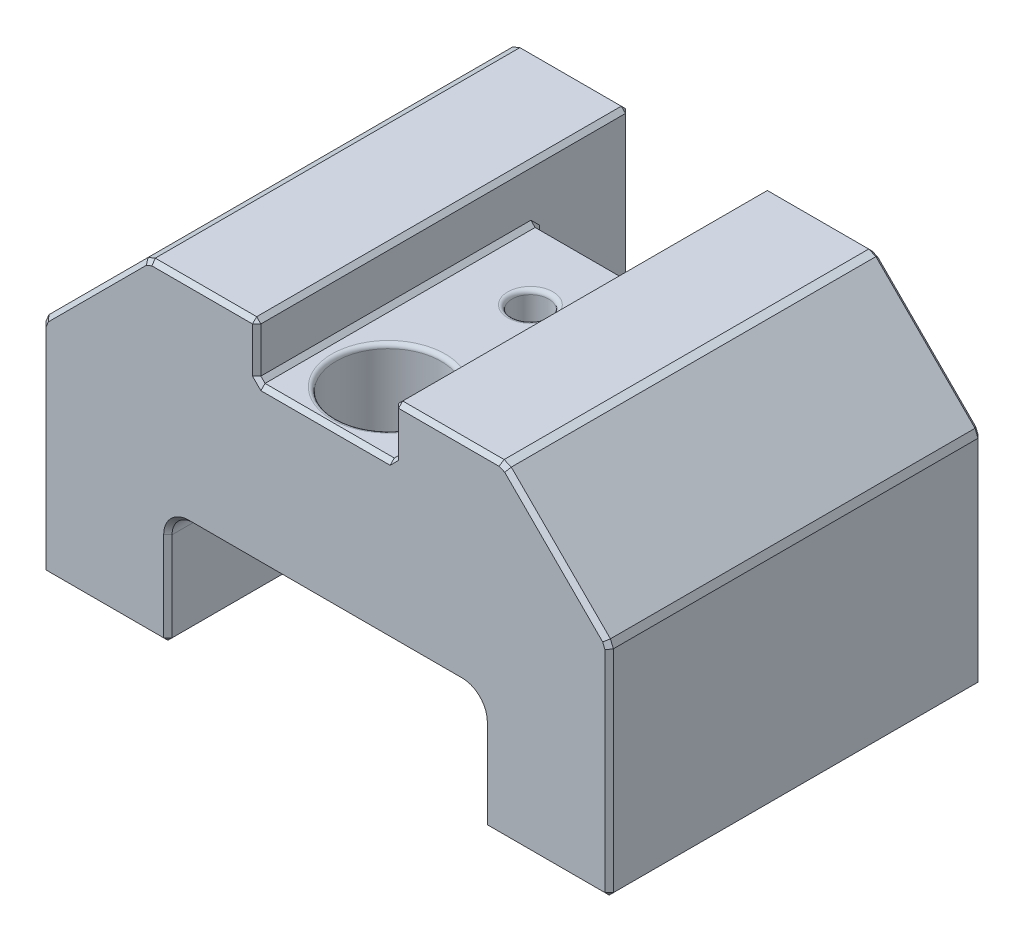
from build123d import *

# Parameters (mm, degrees)
BOSS_EXTRUDE1_DEPTH = 23
BOSS_EXTRUDE5_START = 23
SKETCH1_9_W         = 13.1
SKETCH1_9_H         = 9.8
SKETCH1_9_H_2       = 5.1
BOSS_EXTRUDE5_DEPTH = 12.5
SKETCH1_4_W         = 13.1
SKETCH1_4_H         = 9.8
CUT_EXTRUDE1_DEPTH  = 9
CHAMFER4_SIZE       = 10
CHAMFER6_SIZE       = 0.4
CUT_EXTRUDE5_DEPTH  = 52.525624693
SKETCH6_4_R         = 1.75
SKETCH6_4_R_2       = 5
SKETCH6_4_R_3       = 2.55
CUT_EXTRUDE6_DEPTH  = 12
CHAMFER7_SIZE       = 0.4
FILLET1_R           = 0.4


with BuildPart() as part:
    # Sketch1 → Boss-Extrude1 (new body)
    with BuildSketch(Plane.XY):
        with BuildLine():
            Line((-27, 4.1), (-15, 4.1))
            Line((-15, 4.1), (-15, 13))
            ThreePointArc((-15, 13), (-14.414213562, 14.414213562), (-13, 15))
            Line((-13, 15), (-6.55, 15))
            Line((-6.55, 15), (-6.55, 20.1))
            Line((-6.55, 20.1), (6.55, 20.1))
            Line((6.55, 20.1), (6.55, 15))
            Line((6.55, 15), (13, 15))
            ThreePointArc((13, 15), (14.414213562, 14.414213562), (15, 13))
            Line((15, 13), (15, 4.1))
            Line((15, 4.1), (27, 4.1))
            Line((27, 4.1), (27, 35))
            Line((27, 35), (6.55, 35))
            Line((6.55, 35), (6.55, 29.9))
            Line((6.55, 29.9), (-6.55, 29.9))
            Line((-6.55, 29.9), (-6.55, 35))
            Line((-6.55, 35), (-27, 35))
            Line((-27, 35), (-27, 4.1))
        make_face()
    extrude(amount=BOSS_EXTRUDE1_DEPTH)

    # Sketch1<9> → Boss-Extrude5 (add)
    with BuildSketch(Plane.XY.offset(BOSS_EXTRUDE5_START)):
        with BuildLine():
            Line((-27, 4.1), (-15, 4.1))
            Line((-15, 4.1), (-15, 13))
            ThreePointArc((-15, 13), (-14.414213562, 14.414213562), (-13, 15))
            Line((-13, 15), (-6.55, 15))
            Line((-6.55, 15), (-6.55, 20.1))
            Line((-6.55, 20.1), (-6.55, 29.9))
            Line((-6.55, 29.9), (-6.55, 35))
            Line((-6.55, 35), (-27, 35))
            Line((-27, 35), (-27, 4.1))
        make_face()
        with Locations((0, 25)):
            Rectangle(SKETCH1_9_W, SKETCH1_9_H)
        with BuildLine():
            Line((6.55, 20.1), (6.55, 15))
            Line((6.55, 15), (13, 15))
            ThreePointArc((13, 15), (14.414213562, 14.414213562), (15, 13))
            Line((15, 13), (15, 4.1))
            Line((15, 4.1), (27, 4.1))
            Line((27, 4.1), (27, 35))
            Line((27, 35), (6.55, 35))
            Line((6.55, 35), (6.55, 29.9))
            Line((6.55, 29.9), (6.55, 20.1))
        make_face()
        with Locations((0, 17.55)):
            Rectangle(SKETCH1_9_W, SKETCH1_9_H_2)
    extrude(amount=BOSS_EXTRUDE5_DEPTH)

    # Sketch1<4> → Cut-Extrude1 (cut)
    with BuildSketch(Plane.XY):
        with Locations((0, 25)):
            Rectangle(SKETCH1_4_W, SKETCH1_4_H)
    extrude(amount=CUT_EXTRUDE1_DEPTH, mode=Mode.SUBTRACT)

    # Chamfer4
    chamfer4_edges = [part.edges().sort_by_distance(p)[0] for p in [
        (-27, 35, 17.75),
        (27, 35, 17.75),
    ]]
    chamfer(chamfer4_edges, length=CHAMFER4_SIZE)

    # Chamfer6
    chamfer6_edges = [part.edges().sort_by_distance(p)[0] for p in [
        (17, 35, 17.75),
        (27, 25, 17.75),
        (-27, 25, 17.75),
        (-17, 35, 17.75),
    ]]
    chamfer(chamfer6_edges, length=CHAMFER6_SIZE)

    # Sketch6 → Cut-Extrude5 (cut, through all)
    with BuildSketch(Plane(origin=(0, 29.9, 0), x_dir=(1, 0, 0), z_dir=(0, 1, 0))):
        with BuildLine():
            ThreePointArc((1.75, -16), (1.237436867, -14.762563133), (0, -14.25))
            Line((0, -14.25), (0, -17.75))
            ThreePointArc((0, -17.75), (1.237436867, -17.237436867), (1.75, -16))
        make_face()
        with BuildLine():
            Line((0, -17.75), (0, -14.25))
            ThreePointArc((0, -14.25), (-1.75, -16), (0, -17.75))
        make_face()
        with BuildLine():
            ThreePointArc((2.55, -29.5), (1.803122292, -27.696877708), (0, -26.95))
            Line((0, -26.95), (0, -32.05))
            ThreePointArc((0, -32.05), (1.803122292, -31.303122292), (2.55, -29.5))
        make_face()
        with BuildLine():
            Line((0, -32.05), (0, -26.95))
            ThreePointArc((0, -26.95), (-2.55, -29.5), (0, -32.05))
        make_face()
    extrude(amount=-CUT_EXTRUDE5_DEPTH, mode=Mode.SUBTRACT)

    # Sketch6<4> → Cut-Extrude6 (cut)
    # profile 1 of 2: a face of its own
    with BuildSketch(Plane(origin=(0, 29.9, 0), x_dir=(1, 0, 0), z_dir=(0, 1, 0))):
        with Locations(Location((0, -16, 0), (0, 0, 270))):
            Circle(SKETCH6_4_R)
    # profile 2 of 2: a face of its own
    with BuildSketch(Plane(origin=(0, 29.9, 0), x_dir=(1, 0, 0), z_dir=(0, 1, 0))):
        with Locations(Location((0, -29.5, 0), (0, 0, 270))):
            Circle(SKETCH6_4_R_2)
        with Locations(Location((0, -29.5, 0), (0, 0, 270))):
            Circle(SKETCH6_4_R_3, mode=Mode.SUBTRACT)
    extrude(amount=-CUT_EXTRUDE6_DEPTH, mode=Mode.SUBTRACT)

    # Chamfer7
    chamfer7_edges = [part.edges().sort_by_distance(p)[0] for p in [
        (0, 29.9, 9),
        (6.55, 25, 9),
        (-6.55, 25, 9),
        (0, 20.1, 9),
        (-27, 14.35, 0),
        (-22, 30, 0),
        (-16.941421356, 34.858578644, 0),
        (-26.858578644, 24.941421356, 0),
        (-22, 30, 35.5),
        (27, 14.35, 35.5),
        (22, 30, 35.5),
        (-11.575, 35, 35.5),
        (26.858578644, 24.941421356, 35.5),
        (16.941421356, 34.858578644, 35.5),
        (-16.941421356, 34.858578644, 35.5),
        (-26.858578644, 24.941421356, 35.5),
        (11.575, 35, 0),
        (22, 30, 0),
        (26.858578644, 24.941421356, 0),
        (16.941421356, 34.858578644, 0),
        (9.775, 15, 0),
        (6.55, 25, 0),
        (-6.55, 25, 0),
        (-9.775, 15, 0),
        (-14.414213562, 14.414213562, 0),
        (-15, 8.55, 0),
        (-21, 4.1, 0),
        (-11.575, 35, 0),
        (27, 14.35, 0),
        (21, 4.1, 0),
        (15, 8.55, 0),
        (14.414213562, 14.414213562, 0),
        (6.55, 15, 11.5),
        (6.55, 20.1, 16),
        (-6.55, 20.1, 16),
        (-6.55, 15, 11.5),
        (-15, 4.1, 17.75),
        (-27, 4.1, 17.75),
        (-6.55, 35, 17.75),
        (-6.55, 29.9, 22.25),
        (6.55, 29.9, 22.25),
        (6.55, 35, 17.75),
        (27, 4.1, 17.75),
        (15, 4.1, 17.75),
        (-15, 8.55, 35.5),
        (-14.414213562, 14.414213562, 35.5),
        (0, 15, 35.5),
        (14.414213562, 14.414213562, 35.5),
        (15, 8.55, 35.5),
        (21, 4.1, 35.5),
        (11.575, 35, 35.5),
        (6.55, 32.45, 35.5),
        (-27, 14.35, 35.5),
        (0, 29.9, 35.5),
        (-6.55, 32.45, 35.5),
        (-21, 4.1, 35.5),
        (0, 15, 23),
        (-6.55, 17.55, 23),
        (6.55, 17.55, 23),
    ]]
    chamfer(chamfer7_edges, length=CHAMFER7_SIZE)

    # Fillet1
    fillet1_edges = [part.edges().sort_by_distance(p)[0] for p in [
        (0, 20.1, 14.25),
        (0, 29.9, 14.25),
        (0, 15, 32.05),
        (0, 17.9, 24.5),
        (0, 17.9, 32.05),
        (0, 29.9, 24.5),
    ]]
    fillet(fillet1_edges, radius=FILLET1_R)


solid = part.part
